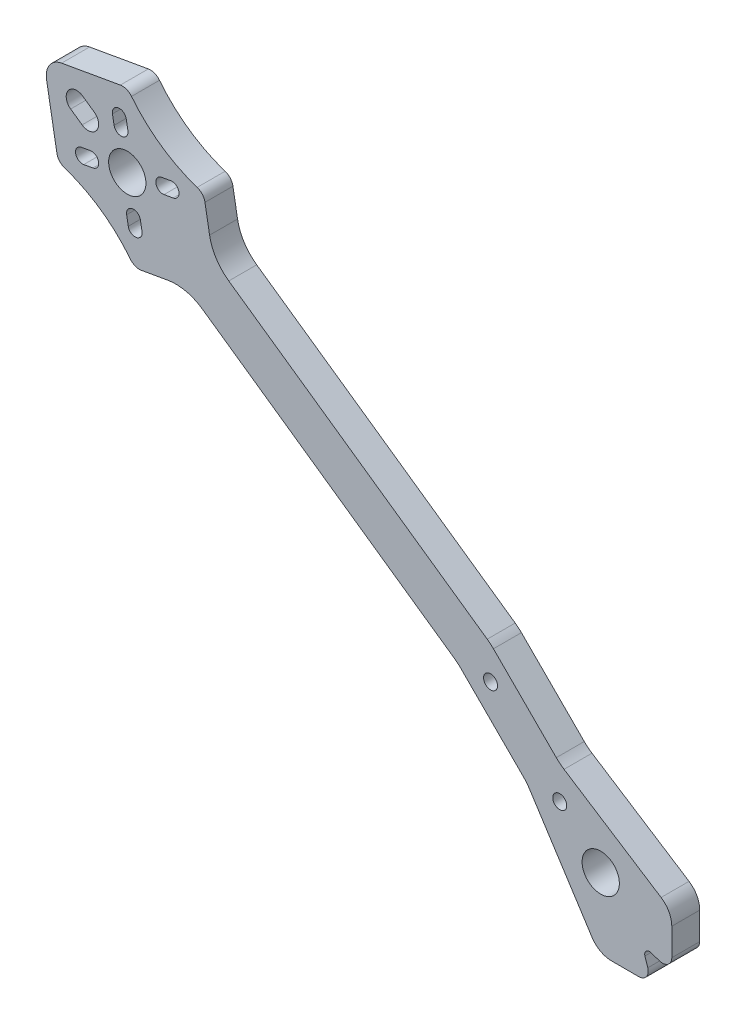
from build123d import *

# Parameters (mm, degrees)
CROQUIS1_R              = 1.5
CROQUIS1_R_2            = 4
SALIENTE_EXTRUIR1_DEPTH = 6
CROQUIS4_R              = 4
SALIENTE_EXTRUIR3_DEPTH = 6
CORTAR_EXTRUIR1_DEPTH   = 6
REDONDEO3_R             = 4
CORTAR_EXTRUIR2_DEPTH   = 6
REDONDEO4_R             = 2.5
REDONDEO6_R             = 10


with BuildPart() as part:
    # Croquis1 → Saliente-Extruir1 (new body)
    with BuildSketch(Plane.XY):
        with BuildLine():
            Line((-17.112213819, 2.294275414), (-30.516043414, 23.123582692))
            ThreePointArc((-30.516043414, 23.123582692), (-31.14080226, 23.989156666), (-31.854269143, 24.783201331))
            Line((-31.854269143, 24.783201331), (-45.961940777, 38.890872965))
            Line((-45.961940777, 38.890872965), (-104.121735922, 79.614799946))
            Line((-104.121735922, 79.614799946), (-98.473110707, 87.681872787))
            Line((-98.473110707, 87.681872787), (-38.890872965, 45.961940777))
            Line((-38.890872965, 45.961940777), (-24.783201331, 31.854269143))
            ThreePointArc((-24.783201331, 31.854269143), (-23.989156666, 31.14080226), (-23.123582692, 30.516043414))
            Line((-23.123582692, 30.516043414), (-2.294275414, 17.112213819))
            ThreePointArc((-2.294275414, 17.112213819), (-0.610887166, 15.302496804), (0, 12.907567049))
            Line((0, 12.907567049), (0, 7.055686841))
            ThreePointArc((0, 7.055686841), (-0.823113423, 5.438609853), (-2.614937985, 5.15257064))
            Line((-2.614937985, 5.15257064), (-4.503911831, 5.762938925))
            ThreePointArc((-4.503911831, 5.762938925), (-5.518487605, 5.518487605), (-5.762938925, 4.503911831))
            Line((-5.762938925, 4.503911831), (-5.15257064, 2.614937985))
            ThreePointArc((-5.15257064, 2.614937985), (-5.438609853, 0.823113423), (-7.055686841, 0))
            Line((-7.055686841, 0), (-12.907567049, 0))
            ThreePointArc((-12.907567049, 0), (-15.302496804, 0.610887166), (-17.112213819, 2.294275414))
        make_face()
        with Locations((-38.890872965, 38.890872965)):
            Circle(CROQUIS1_R, mode=Mode.SUBTRACT)
        with Locations((-24.04163056, 24.04163056)):
            Circle(CROQUIS1_R, mode=Mode.SUBTRACT)
        with Locations((-15.25, 15.25)):
            Circle(CROQUIS1_R_2, mode=Mode.SUBTRACT)
    extrude(amount=SALIENTE_EXTRUIR1_DEPTH)

    # Croquis4 → Saliente-Extruir3 (add)
    with BuildSketch(Plane.XY.offset(6)):
        Polygon((-98.473110707, 87.681872787), (-100.447042684, 98.87659732), (-116.83008357, 110.348126047), (-134.88265713, 107.164970257), (-131.69950134, 89.112396696), (-115.316460454, 77.640867969), (-104.121735922, 79.614799946), align=None)
        with Locations((-116.861312156, 94.546288657)):
            Circle(CROQUIS4_R, mode=Mode.SUBTRACT)
    extrude(amount=-SALIENTE_EXTRUIR3_DEPTH)

    # Croquis5 → Cortar-Extruir1 (cut)
    with BuildSketch(Plane.XY.offset(6)):
        with BuildLine():
            Line((-129.005623724, 100.303084339), (-126.548167592, 98.58235503))
            ThreePointArc((-126.548167592, 98.58235503), (-123.41452851, 99.134900148), (-123.967073628, 102.26853923))
            Line((-123.967073628, 102.26853923), (-126.424529761, 103.989268539))
            ThreePointArc((-126.424529761, 103.989268539), (-129.558168842, 103.436723421), (-129.005623724, 100.303084339))
        make_face()
        with BuildLine():
            Line((-116.992750408, 86.653556305), (-116.645454053, 84.683940799))
            ThreePointArc((-116.645454053, 84.683940799), (-114.907770157, 83.467201436), (-113.691030794, 85.204885332))
            Line((-113.691030794, 85.204885332), (-114.038327149, 87.174500838))
            ThreePointArc((-114.038327149, 87.174500838), (-115.776011045, 88.391240201), (-116.992750408, 86.653556305))
        make_face()
        with BuildLine():
            Line((-108.968579803, 94.414850405), (-106.998964297, 94.76214676))
            ThreePointArc((-106.998964297, 94.76214676), (-105.782224934, 96.499830656), (-107.51990883, 97.716570019))
            Line((-107.51990883, 97.716570019), (-109.489524336, 97.369273664))
            ThreePointArc((-109.489524336, 97.369273664), (-110.706263699, 95.631589768), (-108.968579803, 94.414850405))
        make_face()
        with BuildLine():
            Line((-124.754044508, 94.67772691), (-126.723660014, 94.330430555))
            ThreePointArc((-126.723660014, 94.330430555), (-127.940399377, 92.592746659), (-126.202715481, 91.376007296))
            Line((-126.202715481, 91.376007296), (-124.233099975, 91.723303651))
            ThreePointArc((-124.233099975, 91.723303651), (-123.016360612, 93.460987547), (-124.754044508, 94.67772691))
        make_face()
        with BuildLine():
            Line((-116.729873903, 102.43902101), (-117.077170259, 104.408636516))
            ThreePointArc((-117.077170259, 104.408636516), (-118.814854155, 105.625375879), (-120.031593518, 103.887691983))
            Line((-120.031593518, 103.887691983), (-119.684297162, 101.918076477))
            ThreePointArc((-119.684297162, 101.918076477), (-117.946613266, 100.701337114), (-116.729873903, 102.43902101))
        make_face()
    extrude(amount=-CORTAR_EXTRUIR1_DEPTH, mode=Mode.SUBTRACT)

    # Redondeo3
    redondeo3_edges = [part.edges().sort_by_distance(p)[0] for p in [
        (-134.88265713, 107.164970257, 3),
    ]]
    fillet(redondeo3_edges, radius=REDONDEO3_R)

    # Croquis7 → Cortar-Extruir2 (cut)
    with BuildSketch(Plane.XY.offset(6)):
        with BuildLine():
            Line((-131.69950134, 89.112396696), (-115.316460454, 77.640867969))
            ThreePointArc((-115.316460454, 77.640867969), (-122.523879314, 84.782075048), (-131.69950134, 89.112396696))
        make_face()
        with BuildLine():
            Line((-116.83008357, 110.348126047), (-100.447042684, 98.87659732))
            ThreePointArc((-100.447042684, 98.87659732), (-109.62266471, 103.206918969), (-116.83008357, 110.348126047))
        make_face()
    extrude(amount=-CORTAR_EXTRUIR2_DEPTH, mode=Mode.SUBTRACT)

    # Redondeo4
    redondeo4_edges = [part.edges().sort_by_distance(p)[0] for p in [
        (-115.316460454, 77.640867969, 3),
        (-131.69950134, 89.112396696, 3),
        (-116.83008357, 110.348126047, 3),
        (-100.447042684, 98.87659732, 3),
    ]]
    fillet(redondeo4_edges, radius=REDONDEO4_R)

    # Redondeo6
    redondeo6_edges = [part.edges().sort_by_distance(p)[0] for p in [
        (-38.890872965, 45.961940777, 3),
        (-45.961940777, 38.890872965, 3),
        (-104.121735922, 79.614799946, 3),
        (-98.473110707, 87.681872787, 3),
    ]]
    fillet(redondeo6_edges, radius=REDONDEO6_R)


solid = part.part
